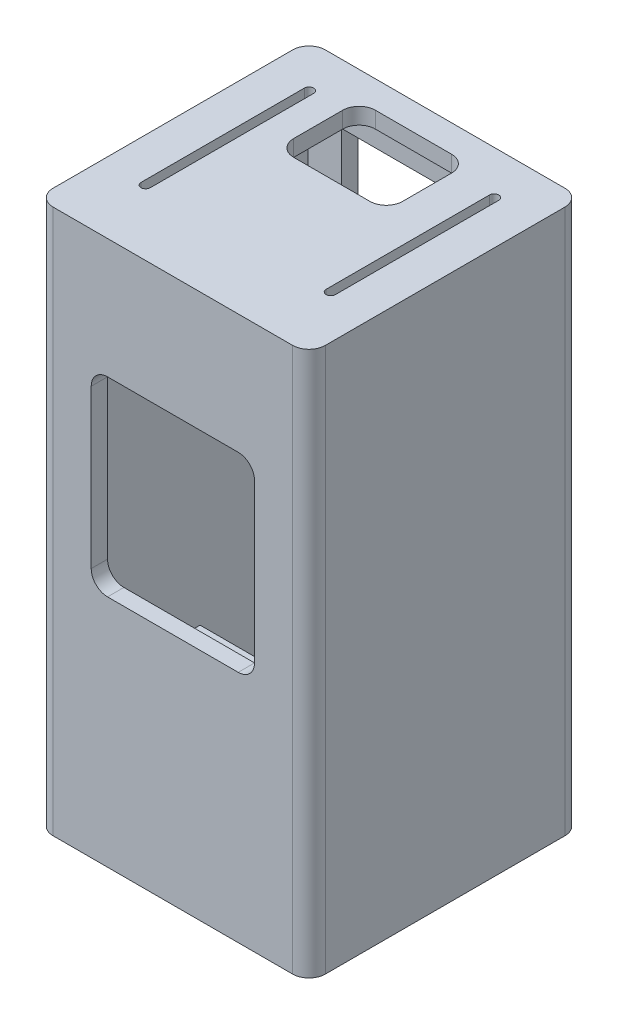
from build123d import *

# Parameters (mm, degrees)
SKETCH_1_W                = 50
SKETCH_1_H                = 50
EXTRUDE_2_DEPTH           = 100
FILLET_4_R                = 3
SKETCH_3_W                = 44
SKETCH_3_H                = 44
CUT_EXTRUDE_4_DEPTH       = 80
SKETCH_3_4_W              = 44
SKETCH_3_4_H              = 44
EXTRUDE_4_DEPTH           = 20
SKETCH_7_W                = 44
SKETCH_7_H                = 20
CUT_EXTRUDE_5_DEPTH       = 20
SKETCH_7_2_W              = 44
SKETCH_7_2_H              = 20
EXTRUDE_5_DEPTH           = 5
SKETCH_9_W                = 44
SKETCH_9_H                = 20
CUT_EXTRUDE_6_DEPTH       = 20
SKETCH_9_2_W              = 44
SKETCH_9_2_H              = 20
EXTRUDE_6_DEPTH           = 3
CUT_EXTRUDE_7_DEPTH       = 5
CUT_EXTRUDE_7_DEPTH_BACK  = 5
SKETCH_15_W               = 44
SKETCH_15_H               = 20
CUT_EXTRUDE_9_DEPTH       = 41
SKETCH_15_2_W             = 44
SKETCH_15_2_H             = 20
EXTRUDE_7_DEPTH           = 15
SKETCH_15_3_W             = 44
SKETCH_15_3_H             = 20
CUT_EXTRUDE_10_DEPTH      = 10
SKETCH_16_W               = 44
SKETCH_16_H               = 20
CUT_EXTRUDE_11_DEPTH      = 30
SKETCH_16_2_W             = 44
SKETCH_16_2_H             = 20
EXTRUDE_8_DEPTH           = 13
SKETCH_16_3_W             = 44
SKETCH_16_3_H             = 20
CUT_EXTRUDE_12_DEPTH      = 10
CUT_EXTRUDE_17_DEPTH      = 40
CUT_EXTRUDE_18_DEPTH      = 5
CUT_EXTRUDE_18_DEPTH_BACK = 4
SKETCH_21_W               = 20
SKETCH_21_H               = 15
CUT_EXTRUDE_19_DEPTH      = 44
SKETCH_23_W               = 32
SKETCH_23_H               = 72
CUT_EXTRUDE_20_DEPTH      = 44
SKETCH_25_W               = 30
SKETCH_25_H               = 35
CUT_EXTRUDE_21_DEPTH      = 40
FILLET_5_R                = 3
FILLET_6_R                = 3


with BuildPart() as part:
    # 草图1 → 凸台-拉伸2 (new body)
    with BuildSketch(Plane(origin=(0, 0, 0), x_dir=(1, 0, 0), z_dir=(0, 1, 0))):
        Rectangle(SKETCH_1_W, SKETCH_1_H)
    extrude(amount=EXTRUDE_2_DEPTH)

    # 圆角4
    fillet_4_edges = [part.edges().sort_by_distance(p)[0] for p in [
        (25, 50, -25),
        (-25, 50, -25),
        (-25, 50, 25),
        (25, 50, 25),
    ]]
    fillet(fillet_4_edges, radius=FILLET_4_R)

    # 草图3 → 切除-拉伸4 (cut)
    with BuildSketch(Plane(origin=(0, 0, 0), x_dir=(1, 0, 0), z_dir=(0, 1, 0))):
        Rectangle(SKETCH_3_W, SKETCH_3_H)
    extrude(amount=CUT_EXTRUDE_4_DEPTH, mode=Mode.SUBTRACT)

    # 草图3<4> → 凸台-拉伸4 (add)
    with BuildSketch(Plane(origin=(0, 0, 0), x_dir=(1, 0, 0), z_dir=(0, 1, 0))):
        Rectangle(SKETCH_3_4_W, SKETCH_3_4_H)
    extrude(amount=EXTRUDE_4_DEPTH)

    # 草图7 → 切除-拉伸5 (cut)
    with BuildSketch(Plane(origin=(0, 0, 0), x_dir=(1, 0, 0), z_dir=(0, 1, 0))):
        with Locations((0, -12)):
            Rectangle(SKETCH_7_W, SKETCH_7_H)
    extrude(amount=CUT_EXTRUDE_5_DEPTH, mode=Mode.SUBTRACT)

    # 草图7<2> → 凸台-拉伸5 (add)
    with BuildSketch(Plane(origin=(0, 0, 0), x_dir=(1, 0, 0), z_dir=(0, 1, 0))):
        with Locations((0, -12)):
            Rectangle(SKETCH_7_2_W, SKETCH_7_2_H)
    extrude(amount=EXTRUDE_5_DEPTH)

    # 草图9 → 切除-拉伸6 (cut)
    with BuildSketch(Plane(origin=(0, 0, 0), x_dir=(1, 0, 0), z_dir=(0, 1, 0))):
        with Locations((0, 12)):
            Rectangle(SKETCH_9_W, SKETCH_9_H)
    extrude(amount=CUT_EXTRUDE_6_DEPTH, mode=Mode.SUBTRACT)

    # 草图9<2> → 凸台-拉伸6 (add)
    with BuildSketch(Plane(origin=(0, 0, 0), x_dir=(1, 0, 0), z_dir=(0, 1, 0))):
        with Locations((0, 12)):
            Rectangle(SKETCH_9_2_W, SKETCH_9_2_H)
    extrude(amount=EXTRUDE_6_DEPTH)

    # 草图10 → 切除-拉伸7 (cut, two sides: drawn at the far end of the back side and taken through both)
    with BuildSketch(Plane.XY.offset(-CUT_EXTRUDE_7_DEPTH_BACK)):
        with BuildLine():
            Line((-11.15, 18), (-11.15, 12))
            ThreePointArc((-11.15, 12), (-12, 11.15), (-12.85, 12))
            Line((-12.85, 12), (-12.85, 18))
            ThreePointArc((-12.85, 18), (-12, 18.85), (-11.15, 18))
        make_face()
        with BuildLine():
            Line((12.85, 18), (12.85, 12))
            ThreePointArc((12.85, 12), (12, 11.15), (11.15, 12))
            Line((11.15, 12), (11.15, 18))
            ThreePointArc((11.15, 18), (12, 18.85), (12.85, 18))
        make_face()
    extrude(amount=CUT_EXTRUDE_7_DEPTH + CUT_EXTRUDE_7_DEPTH_BACK, mode=Mode.SUBTRACT)

    # 草图15 → 切除-拉伸9 (cut)
    with BuildSketch(Plane(origin=(0, 110, 0), x_dir=(1, 0, 0), z_dir=(0, 1, 0))):
        with Locations((0, -12)):
            Rectangle(SKETCH_15_W, SKETCH_15_H)
    extrude(amount=-CUT_EXTRUDE_9_DEPTH, mode=Mode.SUBTRACT)

    # 草图15<2> → 凸台-拉伸7 (add)
    with BuildSketch(Plane(origin=(0, 110, 0), x_dir=(1, 0, 0), z_dir=(0, 1, 0))):
        with Locations((0, -12)):
            Rectangle(SKETCH_15_2_W, SKETCH_15_2_H)
    extrude(amount=-EXTRUDE_7_DEPTH)

    # 草图15<3> → 切除-拉伸10 (cut)
    with BuildSketch(Plane(origin=(0, 110, 0), x_dir=(1, 0, 0), z_dir=(0, 1, 0))):
        with Locations((0, -12)):
            Rectangle(SKETCH_15_3_W, SKETCH_15_3_H)
    extrude(amount=-CUT_EXTRUDE_10_DEPTH, mode=Mode.SUBTRACT)

    # 草图16 → 切除-拉伸11 (cut)
    with BuildSketch(Plane(origin=(0, 110, 0), x_dir=(1, 0, 0), z_dir=(0, 1, 0))):
        with Locations((-0.197660017, 12)):
            Rectangle(SKETCH_16_W, SKETCH_16_H)
    extrude(amount=-CUT_EXTRUDE_11_DEPTH, mode=Mode.SUBTRACT)

    # 草图16<2> → 凸台-拉伸8 (add)
    with BuildSketch(Plane(origin=(0, 110, 0), x_dir=(1, 0, 0), z_dir=(0, 1, 0))):
        with Locations((-0.197660017, 12)):
            Rectangle(SKETCH_16_2_W, SKETCH_16_2_H)
    extrude(amount=-EXTRUDE_8_DEPTH)

    # 草图16<3> → 切除-拉伸12 (cut)
    with BuildSketch(Plane(origin=(0, 110, 0), x_dir=(1, 0, 0), z_dir=(0, 1, 0))):
        with Locations((-0.197660017, 12)):
            Rectangle(SKETCH_16_3_W, SKETCH_16_3_H)
    extrude(amount=-CUT_EXTRUDE_12_DEPTH, mode=Mode.SUBTRACT)

    # 草图11 → 切除-拉伸17 (cut)
    with BuildSketch(Plane(origin=(0, 110, 0), x_dir=(1, 0, 0), z_dir=(0, 1, 0))):
        with BuildLine():
            Line((-16.15, 17), (-16.15, -13))
            ThreePointArc((-16.15, -13), (-17, -13.85), (-17.85, -13))
            Line((-17.85, -13), (-17.85, 17))
            ThreePointArc((-17.85, 17), (-17, 17.85), (-16.15, 17))
        make_face()
        with BuildLine():
            Line((17.85, 17), (17.85, -13))
            ThreePointArc((17.85, -13), (17, -13.85), (16.15, -13))
            Line((16.15, -13), (16.15, 17))
            ThreePointArc((16.15, 17), (17, 17.85), (17.85, 17))
        make_face()
    extrude(amount=-CUT_EXTRUDE_17_DEPTH, mode=Mode.SUBTRACT)

    # 草图20 → 切除-拉伸18 (cut, two sides: drawn at the far end of the back side and taken through both)
    with BuildSketch(Plane.XY.offset(-CUT_EXTRUDE_18_DEPTH_BACK)):
        with BuildLine():
            Line((-11.15, 90), (-11.15, 82))
            ThreePointArc((-11.15, 82), (-12, 81.15), (-12.85, 82))
            Line((-12.85, 82), (-12.85, 90))
            ThreePointArc((-12.85, 90), (-12, 90.85), (-11.15, 90))
        make_face()
        with BuildLine():
            Line((12.85, 90), (12.85, 82))
            ThreePointArc((12.85, 82), (12, 81.15), (11.15, 82))
            Line((11.15, 82), (11.15, 90))
            ThreePointArc((11.15, 90), (12, 90.85), (12.85, 90))
        make_face()
    extrude(amount=CUT_EXTRUDE_18_DEPTH + CUT_EXTRUDE_18_DEPTH_BACK, mode=Mode.SUBTRACT)

    # 草图21 → 切除-拉伸19 (cut)
    with BuildSketch(Plane(origin=(0, 110, 0), x_dir=(1, 0, 0), z_dir=(0, 1, 0))):
        with Locations((-0.808809207, 12.5)):
            Rectangle(SKETCH_21_W, SKETCH_21_H)
    extrude(amount=-CUT_EXTRUDE_19_DEPTH, mode=Mode.SUBTRACT)

    # 草图23 → 切除-拉伸20 (cut)
    with BuildSketch(Plane.XY):
        with Locations((0, 56)):
            Rectangle(SKETCH_23_W, SKETCH_23_H)
    extrude(amount=-CUT_EXTRUDE_20_DEPTH, mode=Mode.SUBTRACT)

    # 草图25 → 切除-拉伸21 (cut)
    with BuildSketch(Plane.XY):
        with Locations((0, 60.5)):
            Rectangle(SKETCH_25_W, SKETCH_25_H)
    extrude(amount=CUT_EXTRUDE_21_DEPTH, mode=Mode.SUBTRACT)

    # 圆角5
    fillet_5_edges = [part.edges().sort_by_distance(p)[0] for p in [
        (-15, 43, 23.5),
        (15, 43, 23.5),
        (15, 78, 23.5),
        (-15, 78, 23.5),
    ]]
    fillet(fillet_5_edges, radius=FILLET_5_R)

    # 圆角6
    fillet_6_edges = [part.edges().sort_by_distance(p)[0] for p in [
        (-10.808809207, 98.5, -5),
        (-10.808809207, 98.5, -20),
        (9.191190793, 98.5, -20),
        (9.191190793, 98.5, -5),
    ]]
    fillet(fillet_6_edges, radius=FILLET_6_R)


solid = part.part
